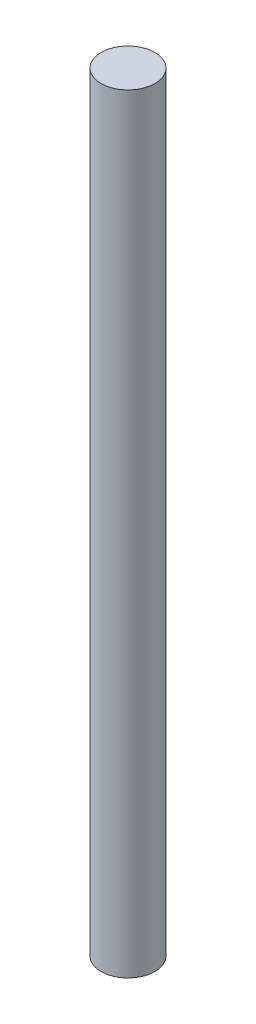
from build123d import *

# Parameters (mm, degrees)
SKETCH1_W = 1.4
SKETCH1_H = 40


with BuildPart() as part:
    # Sketch1 → Revolve1 (revolve)
    with BuildSketch(Plane.XY, mode=Mode.PRIVATE) as revolve1_sk:
        Rectangle(SKETCH1_W, SKETCH1_H)
    revolve(revolve1_sk.sketch.rotate(Axis((0.7, 20, 0), (0, -1, 0)), 270), axis=Axis((0.7, 20, 0), (0, -1, 0)))


solid = part.part
